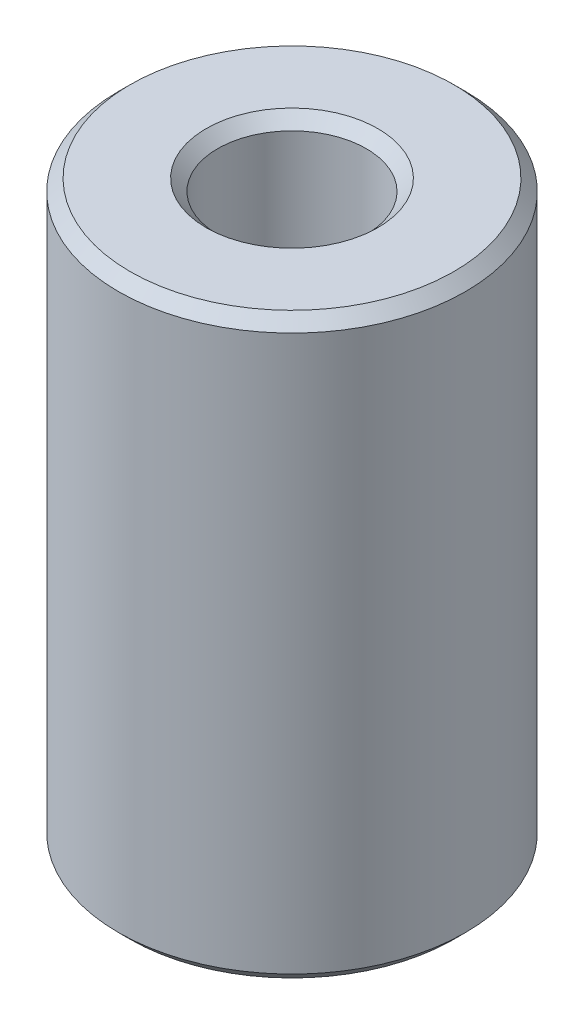
from build123d import *

# Parameters (mm, degrees)
SKETCH1_R                    = 3.81
BOSS_EXTRUDE1_DEPTH          = 12.7
F_30_0_1285_DIAMETER_HOLE1_D = 3.2639
CHAMFER1_SIZE                = 0.254


with BuildPart() as part:
    # Sketch1 → Boss-Extrude1 (new body)
    with BuildSketch(Plane(origin=(0, 0, 0), x_dir=(1, 0, 0), z_dir=(0, 1, 0))):
        with Locations(Location((0, 0, 0), (0, 0, 270))):
            Circle(SKETCH1_R)
    extrude(amount=-BOSS_EXTRUDE1_DEPTH)

    # #30 (0.1285) Diameter Hole1 (through all)
    with Locations(Plane(origin=(0, 0, 0), x_dir=(1, 0, 0), z_dir=(0, 1, 0))):
        with Locations((0, 0)):
            Hole(F_30_0_1285_DIAMETER_HOLE1_D / 2)

    # Chamfer1
    chamfer1_edges = [part.edges().sort_by_distance(p)[0] for p in [
        (0, 0, -3.81),
        (0, -12.7, -3.81),
        (1.63195, 0, 0),
        (1.63195, -12.7, 0),
    ]]
    chamfer(chamfer1_edges, length=CHAMFER1_SIZE)


solid = part.part
